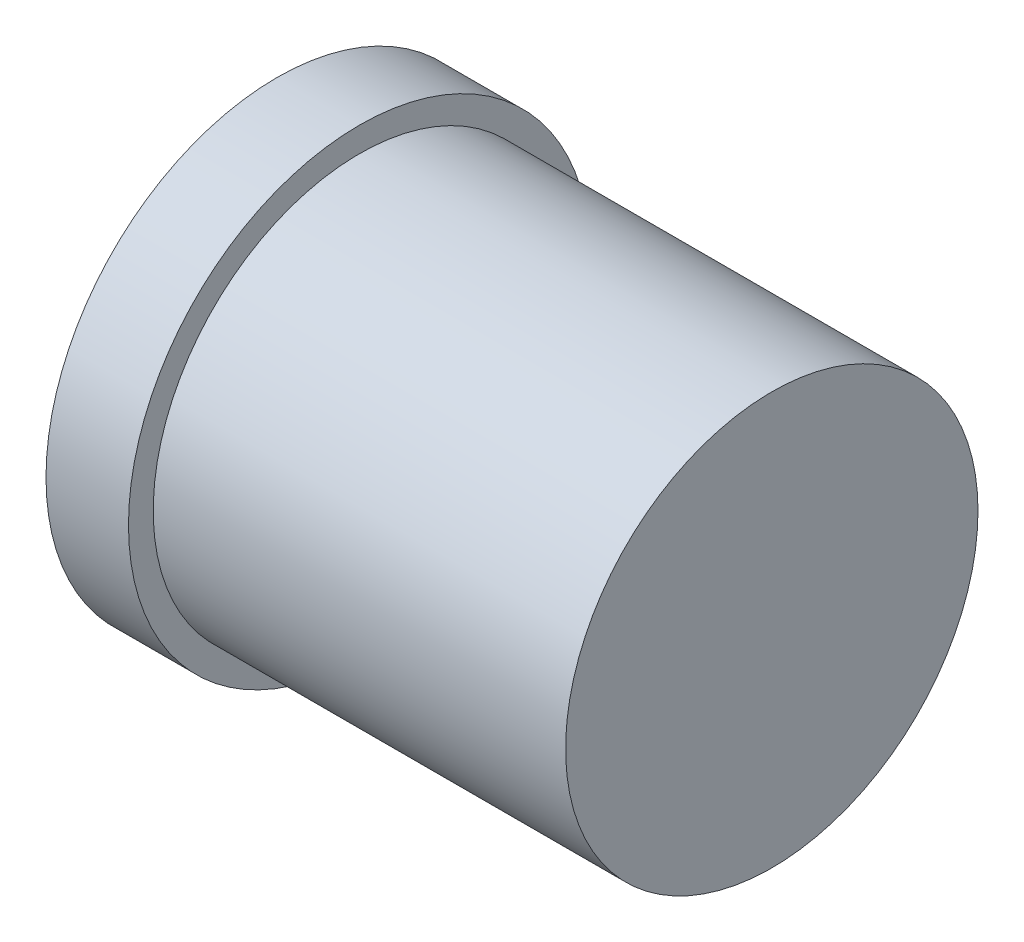
from build123d import *

# Parameters (mm, degrees)
SKETCH1_R           = 14
BOSS_EXTRUDE1_DEPTH = 5
SKETCH2_R           = 12.5
BOSS_EXTRUDE2_DEPTH = 25


with BuildPart() as part:
    # Sketch1 → Boss-Extrude1 (new body)
    with BuildSketch(Plane(origin=(0, 0, 0), x_dir=(0, 0, -1), z_dir=(1, 0, 0))):
        Circle(SKETCH1_R)
    extrude(amount=BOSS_EXTRUDE1_DEPTH)

    # Sketch2 → Boss-Extrude2 (add)
    with BuildSketch(Plane(origin=(5, 0, 0), x_dir=(0, 0, -1), z_dir=(1, 0, 0))):
        Circle(SKETCH2_R)
    extrude(amount=BOSS_EXTRUDE2_DEPTH)


solid = part.part
